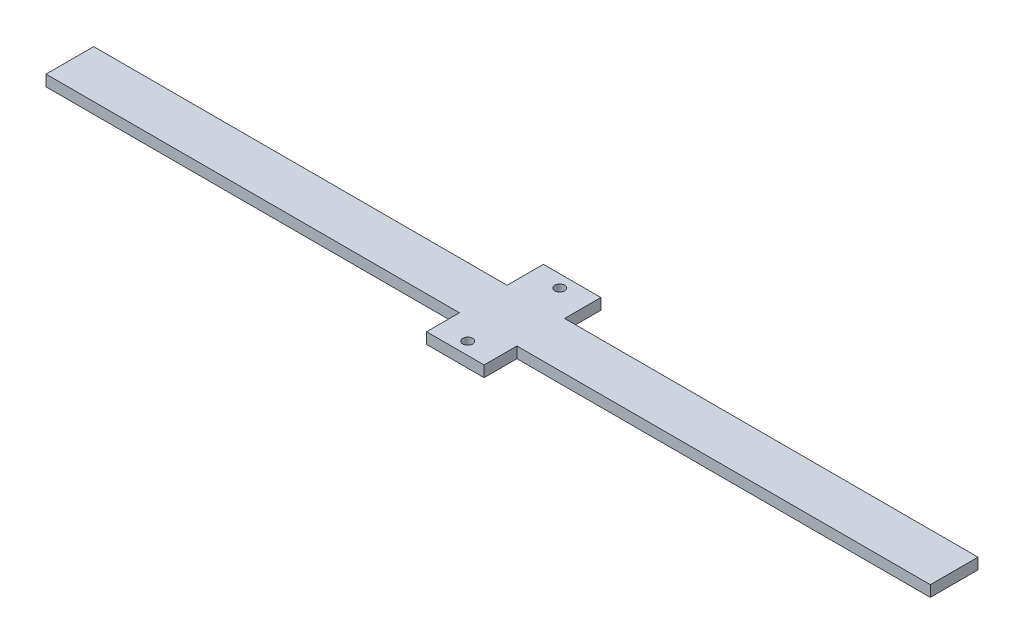
from build123d import *

# Parameters (mm, degrees)
SKETCH1_R           = 1.4224
BOSS_EXTRUDE1_DEPTH = 3.175


with BuildPart() as part:
    # Sketch1 → Boss-Extrude1 (new body)
    with BuildSketch(Plane(origin=(0, 0, 0), x_dir=(1, 0, 0), z_dir=(0, 1, 0))):
        Polygon((0, 0), (0, 13.6906), (118.745, 13.6906), (118.745, 24.118454648), (135.255, 24.118454648), (135.255, 13.6906), (254, 13.6906), (254, 0), (135.255, 0), (135.255, -9.427702707), (118.745, -9.427702707), (118.745, 0), align=None)
        with Locations(Location((127, 20.562454648, 0), (0, 0, 270))):
            Circle(SKETCH1_R, mode=Mode.SUBTRACT)
        with Locations(Location((127, -5.871702707, 0), (0, 0, 270))):
            Circle(SKETCH1_R, mode=Mode.SUBTRACT)
    extrude(amount=BOSS_EXTRUDE1_DEPTH)


solid = part.part
